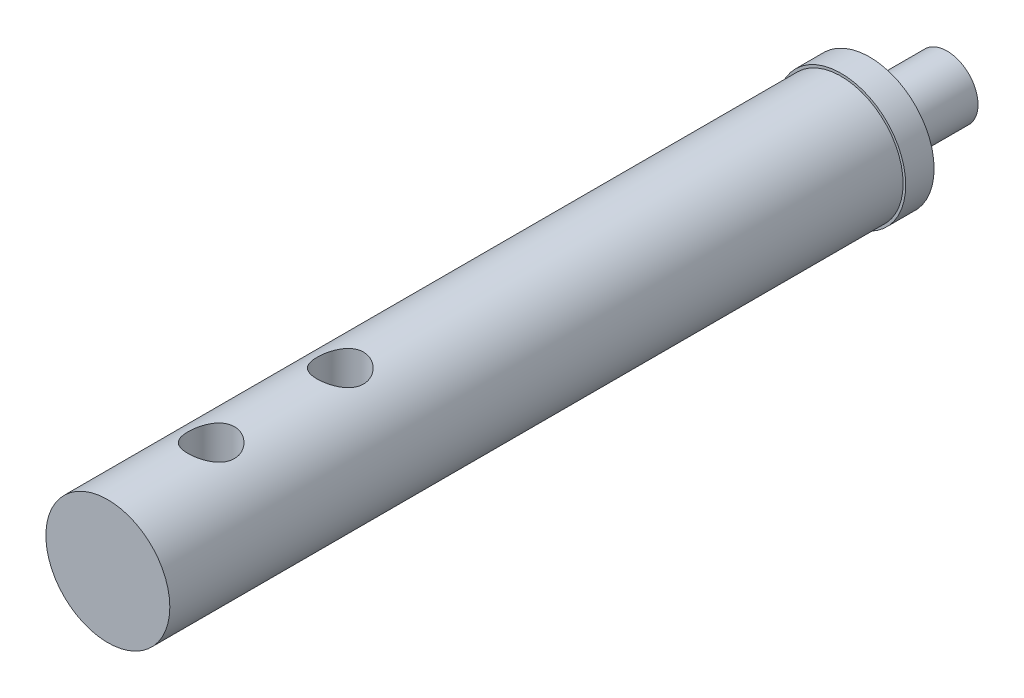
from build123d import *

# Parameters (mm, degrees)
SKETCH1_R           = 6
BOSS_EXTRUDE1_DEPTH = 15
SKETCH2_R           = 12.5
BOSS_EXTRUDE2_DEPTH = 5.5
SKETCH3_R           = 12
BOSS_EXTRUDE3_DEPTH = 142
SKETCH4_R           = 4.5
CUT_EXTRUDE1_DEPTH  = 164.458710383
LPATTERN1_COUNT     = 2
LPATTERN1_PITCH     = 25


with BuildPart() as part:
    # Sketch1 → Boss-Extrude1 (new body)
    with BuildSketch(Plane.XY):
        Circle(SKETCH1_R)
    extrude(amount=BOSS_EXTRUDE1_DEPTH)

    # Sketch2 → Boss-Extrude2 (add)
    with BuildSketch(Plane.XY.offset(15)):
        Circle(SKETCH2_R)
    extrude(amount=BOSS_EXTRUDE2_DEPTH)

    # Sketch3 → Boss-Extrude3 (add)
    with BuildSketch(Plane.XY.offset(20.5)):
        Circle(SKETCH3_R)
    extrude(amount=BOSS_EXTRUDE3_DEPTH)

    # Sketch4 → Cut-Extrude1 (cut, symmetric)
    with BuildSketch(Plane(origin=(0, 0, 0), x_dir=(1, 0, 0), z_dir=(0, 1, 0))):
        with Locations(Location((0, -142.5, 0), (0, 0, 270))):
            Circle(SKETCH4_R)
    cut_extrude1 = extrude(amount=CUT_EXTRUDE1_DEPTH, both=True, mode=Mode.SUBTRACT)

    # LPattern1: Cut-Extrude1 ×2
    with Locations(*[(0, 0, -i * LPATTERN1_PITCH) for i in range(1, LPATTERN1_COUNT)]):
        add(cut_extrude1, mode=Mode.SUBTRACT)


solid = part.part
